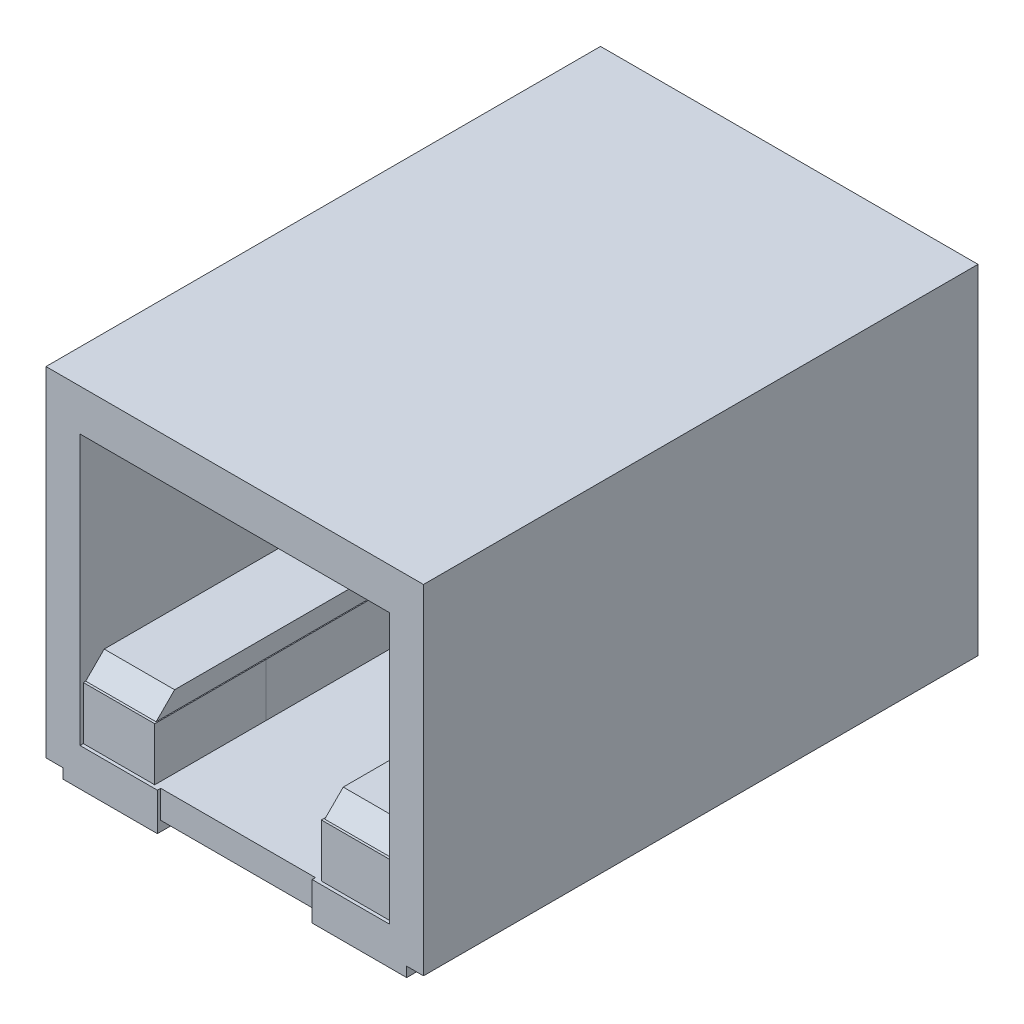
from build123d import *

# Parameters (mm, degrees)
SKETCH1_W          = 21.3
SKETCH1_H          = 13.02
EXTRUDE1_DEPTH     = 7.25
CUT_EXTRUDE1_DEPTH = 0.127
CUT_EXTRUDE2_DEPTH = 11.303
EXTRUDE2_DEPTH     = 3.79984
CUT_EXTRUDE3_START = -11.43
SKETCH5_W          = 0.44704
SKETCH5_H          = 3.302
CUT_EXTRUDE3_DEPTH = 8.89
EXTRUDE3_DEPTH     = 2.7051
EXTRUDE4_DEPTH     = 0.381


with BuildPart() as part:
    # Sketch1 → Extrude1 (new, symmetric)
    with BuildSketch(Plane(origin=(0, 0, 0), x_dir=(0, 0, -1), z_dir=(1, 0, 0))):
        with Locations((-10.65, 6.51)):
            Rectangle(SKETCH1_W, SKETCH1_H)
    extrude(amount=EXTRUDE1_DEPTH, both=True)

    # Sketch2 → Cut-Extrude1 (cut)
    with BuildSketch(Plane.XY.offset(21.3)):
        Polygon((-5.9436, 11.43), (5.9436, 11.43), (5.9436, 1.0668), (2.9718, 1.0668), (2.9718, 0), (-2.9718, 0), (-2.9718, 1.0668), (-5.9436, 1.0668), align=None)
    extrude(amount=-CUT_EXTRUDE1_DEPTH, mode=Mode.SUBTRACT)

    # Sketch3 → Cut-Extrude2 (cut)
    with BuildSketch(Plane.XY.offset(21.173)):
        Polygon((-5.9436, 3.0988), (-3.2004, 3.0988), (-3.2004, 1.0668), (3.2004, 1.0668), (3.2004, 3.0988), (5.9436, 3.0988), (5.9436, 11.43), (-5.9436, 11.43), align=None)
    extrude(amount=-CUT_EXTRUDE2_DEPTH, mode=Mode.SUBTRACT)

    # Sketch4 → Extrude2 (add, symmetric)
    with BuildSketch(Plane(origin=(0, 0, 0), x_dir=(0, 0, -1), z_dir=(1, 0, 0))):
        Polygon((-17.592809528, 11.43), (-18.76, 11.43), (-9.87, 8.128), (-9.87, 8.56152789), align=None)
    extrude(amount=EXTRUDE2_DEPTH, both=True)

    # Sketch5 → Cut-Extrude3 (cut)
    with BuildSketch(Plane.XY.offset(21.3).offset(CUT_EXTRUDE3_START)):
        with Locations((-3.12928, 9.779)):
            Rectangle(SKETCH5_W, SKETCH5_H)
        with Locations((-2.2352, 9.779)):
            Rectangle(SKETCH5_W, SKETCH5_H)
        with Locations((-1.34112, 9.779)):
            Rectangle(SKETCH5_W, SKETCH5_H)
        with Locations((-0.44704, 9.779)):
            Rectangle(SKETCH5_W, SKETCH5_H)
        with Locations((0.44704, 9.779)):
            Rectangle(SKETCH5_W, SKETCH5_H)
        with Locations((1.34112, 9.779)):
            Rectangle(SKETCH5_W, SKETCH5_H)
        with Locations((2.2352, 9.779)):
            Rectangle(SKETCH5_W, SKETCH5_H)
        with Locations((3.12928, 9.779)):
            Rectangle(SKETCH5_W, SKETCH5_H)
    extrude(amount=CUT_EXTRUDE3_DEPTH, mode=Mode.SUBTRACT)

    # Sketch6 → Extrude3 (add)
    with BuildSketch(Plane(origin=(-5.9436, 0, 0), x_dir=(0, 0, -1), z_dir=(1, 0, 0))):
        Polygon((-9.87, 3.0988), (-21.082, 3.0988), (-20.3708, 3.81), (-12.446, 3.81), (-12.446, 4.826), (-9.87, 4.826), align=None)
    extrude3 = extrude(amount=EXTRUDE3_DEPTH)

    # Mirror1: Extrude3 across plane
    add(extrude3.mirror(Plane(origin=(0, 0, 0), x_dir=(0, 0, 1), z_dir=(1, 0, 0))))

    # Sketch14 → Extrude4 (add)
    with BuildSketch(Plane.XZ):
        Polygon((-6.604, 21.3), (-2.9718, 21.3), (-2.9718, 20.792), (2.9718, 20.792), (2.9718, 21.3), (6.604, 21.3), (6.604, 18.252), (-6.604, 18.252), align=None)
    extrude(amount=EXTRUDE4_DEPTH)


solid = part.part
